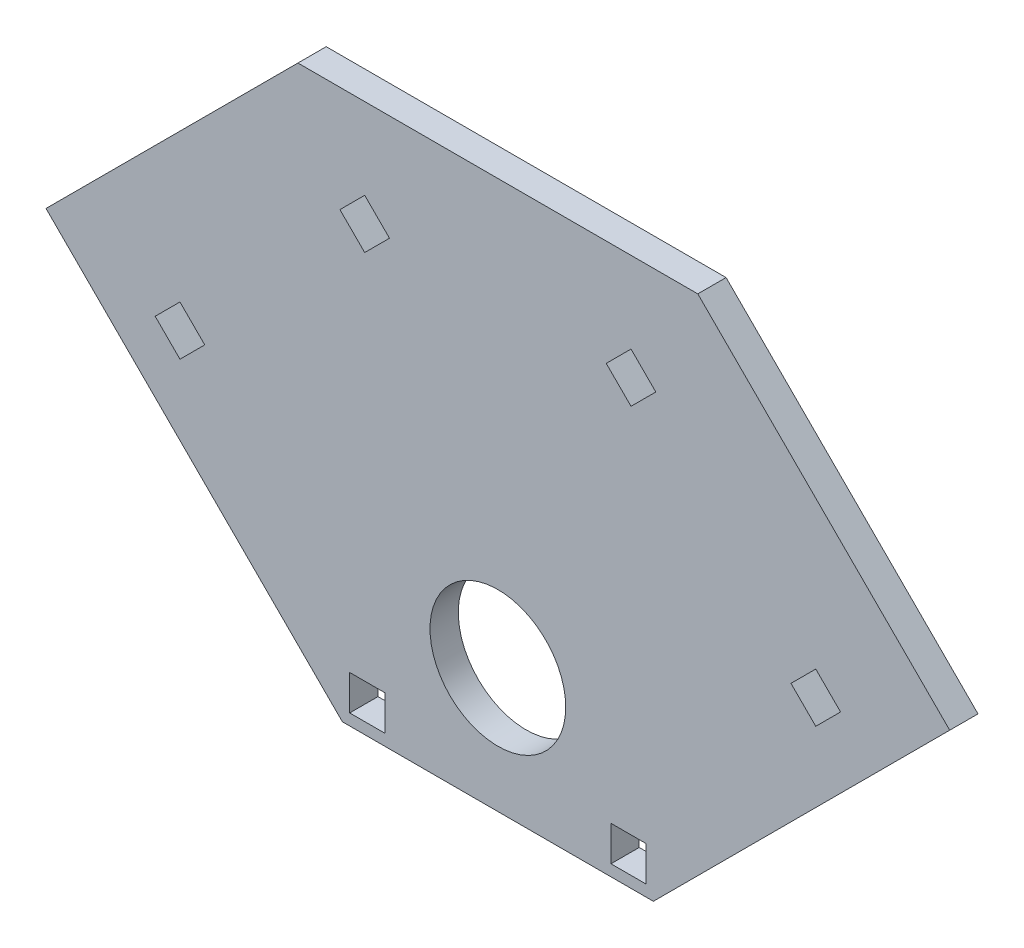
from build123d import *

# Parameters (mm, degrees)
SKETCH3_R           = 12
SKETCH3_W           = 6.2
SKETCH3_H           = 6.2
BOSS_EXTRUDE1_DEPTH = 5


with BuildPart() as part:
    # Sketch3 → Boss-Extrude1 (new body)
    with BuildSketch(Plane.XY):
        Polygon((-69.296464556, 41.012193309), (-41.012193309, 69.296464556), (-35.355339059, 74.953318806), (35.355339059, 74.953318806), (41.012193309, 69.296464556), (69.296464556, 41.012193309), (79.903066274, 30.405591591), (27.497474683, -22), (-27.497474683, -22), (-79.903066274, 30.405591591), align=None)
        Circle(SKETCH3_R, mode=Mode.SUBTRACT)
        Polygon((-60.599051148, 23.546655814), (-56.214989104, 27.930717857), (-51.830927061, 23.546655814), (-56.214989104, 19.16259377), align=None, mode=Mode.SUBTRACT)
        Polygon((-27.930717857, 56.214989104), (-23.546655814, 60.599051148), (-19.16259377, 56.214989104), (-23.546655814, 51.830927061), align=None, mode=Mode.SUBTRACT)
        Polygon((19.16259377, 56.214989104), (23.546655814, 51.830927061), (27.930717857, 56.214989104), (23.546655814, 60.599051148), align=None, mode=Mode.SUBTRACT)
        with Locations((-23.1, -16.9)):
            Rectangle(SKETCH3_W, SKETCH3_H, mode=Mode.SUBTRACT)
        Polygon((51.830927061, 23.546655814), (56.214989104, 19.16259377), (60.599051148, 23.546655814), (56.214989104, 27.930717857), align=None, mode=Mode.SUBTRACT)
        with Locations((23.1, -16.9)):
            Rectangle(SKETCH3_W, SKETCH3_H, mode=Mode.SUBTRACT)
    extrude(amount=BOSS_EXTRUDE1_DEPTH)


solid = part.part
